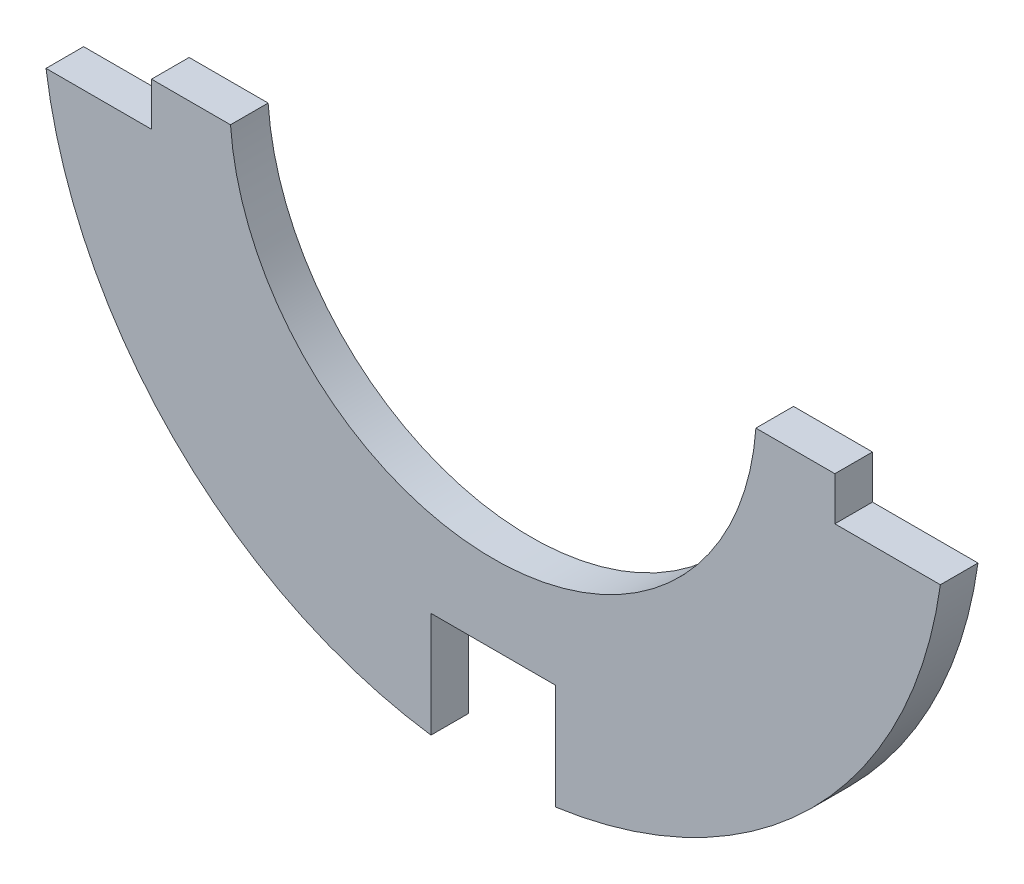
from build123d import *

# Parameters (mm, degrees)
BOSS_EXTRUDE4_DEPTH = 6.35


with BuildPart() as part:
    # Sketch1 → Boss-Extrude4 (new, symmetric)
    with BuildSketch(Plane.XY):
        with BuildLine():
            Line((21, -150.946215587), (21, -115.332))
            Line((21, -115.332), (0, -115.332))
            Line((0, -115.332), (0, -88.9))
            ThreePointArc((0, -88.9), (60.57513929, -65.068137364), (88.672924278, -6.35))
            Line((88.672924278, -6.35), (115.332, -6.35))
            Line((115.332, -6.35), (115.332, -21))
            Line((115.332, -21), (150.946215587, -21))
            ThreePointArc((150.946215587, -21), (107.763073453, -107.763073453), (21, -150.946215587))
        make_face()
    boss_extrude4 = extrude(amount=BOSS_EXTRUDE4_DEPTH, both=True)

    # Mirror1: Boss-Extrude4 across plane
    add(boss_extrude4.mirror(Plane(origin=(0, 0, 0), x_dir=(0, 0, 1), z_dir=(1, 0, 0))))


solid = part.part
